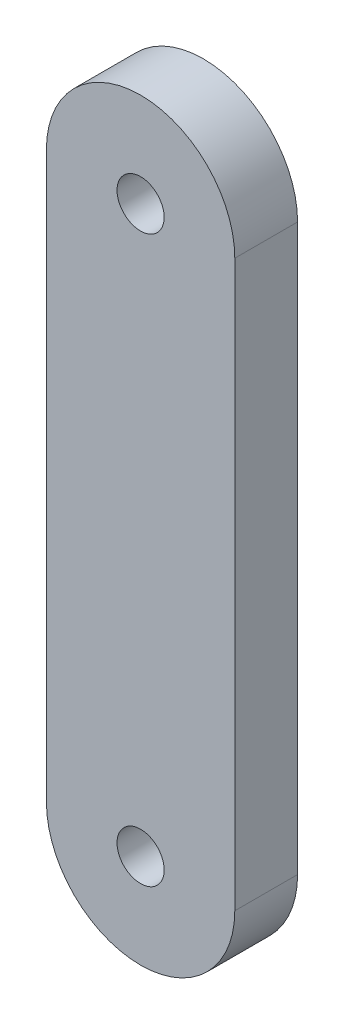
from build123d import *

# Parameters (mm, degrees)
SKETCH_1_R      = 3
EXTRUDE_1_DEPTH = 8


with BuildPart() as part:
    # 草图1 → 凸台-拉伸1 (new body)
    with BuildSketch(Plane.XY.offset(8)):
        with BuildLine():
            Line((12, -36), (12, 36))
            ThreePointArc((12, 36), (0, 48), (-12, 36))
            Line((-12, 36), (-12, -36))
            ThreePointArc((-12, -36), (0, -48), (12, -36))
        make_face()
        with Locations(Location((0, -36, 0), (0, 0, 180))):
            Circle(SKETCH_1_R, mode=Mode.SUBTRACT)
        with Locations(Location((0, 36, 0), (0, 0, 180))):
            Circle(SKETCH_1_R, mode=Mode.SUBTRACT)
    extrude(amount=-EXTRUDE_1_DEPTH)


solid = part.part
